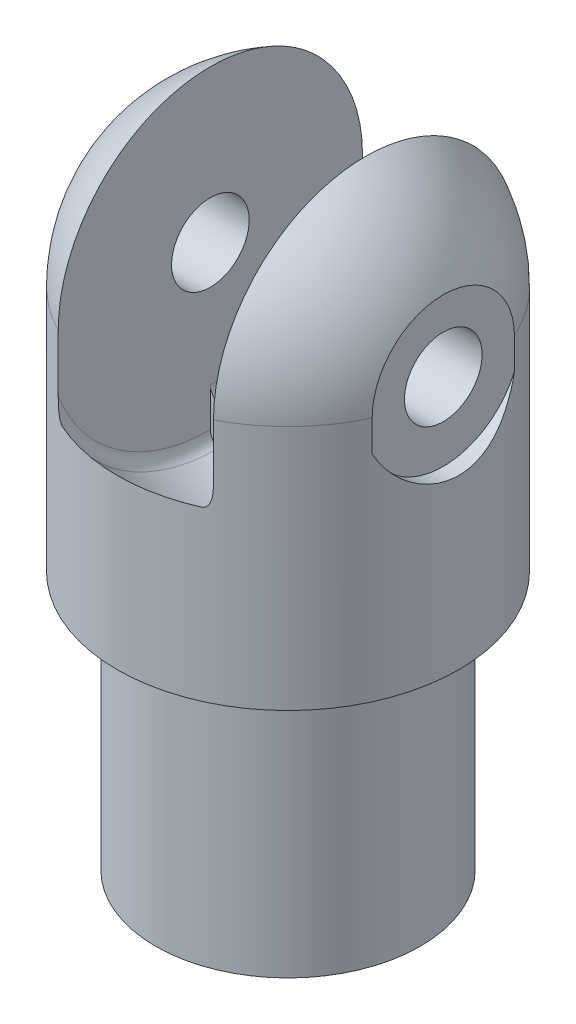
from build123d import *

# Parameters (mm, degrees)
SKETCH1_R                     = 12.9921
BOSS_EXTRUDE1_DEPTH           = 25.4
CUT_EXTRUDE1_DEPTH            = 102.12582981
CUT_EXTRUDE1_DEPTH_BACK       = 102.12582981
SKETCH3_R                     = 3.81
CUT_REVOLVE10_ANGLE           = 90
CUT_REVOLVE10_OTHER_WAY_ANGLE = 180
CUT_EXTRUDE4_DEPTH            = 32.004
FILLET1_R                     = 1.27
SKETCH15_R                    = 7.62
CUT_EXTRUDE5_DEPTH            = 10.16


with BuildPart() as part:
    # Sketch1 → Boss-Extrude1 (new body)
    with BuildSketch(Plane(origin=(0, 0, 0), x_dir=(1, 0, 0), z_dir=(0, 1, 0))):
        Circle(SKETCH1_R)
    extrude(amount=BOSS_EXTRUDE1_DEPTH)

    # Sketch2 → Revolve1 (revolve)
    with BuildSketch(Plane(origin=(0, 0, 0), x_dir=(0, 0, -1), z_dir=(1, 0, 0))):
        with BuildLine():
            Line((-16.764, 25.4), (-16.764, 49.53))
            ThreePointArc((-16.764, 49.53), (-11.85393808, 61.38393808), (0, 66.294))
            Line((0, 66.294), (0, 25.4))
            Line((0, 25.4), (-16.764, 25.4))
        make_face()
    revolve(axis=Axis((0, 25.4, 0), (0, 1, 0)))

    # Sketch3 → Cut-Extrude1 (cut, two sides: drawn at the far end of the back side and taken through both)
    with BuildSketch(Plane(origin=(0, 98.307528007, 0), x_dir=(0, 0, -1), z_dir=(-1, 0, 0)).offset(-CUT_EXTRUDE1_DEPTH_BACK)):
        with Locations((0, 48.777528007)):
            Circle(SKETCH3_R)
    extrude(amount=CUT_EXTRUDE1_DEPTH + CUT_EXTRUDE1_DEPTH_BACK, mode=Mode.SUBTRACT)

    # Sketch11 → Cut-Revolve10 (revolve, cut)
    with BuildSketch(Plane.XY):
        with BuildLine():
            Line((-7.62, 49.53), (-7.62, 66.294481054))
            ThreePointArc((-7.62, 66.294481054), (0, 67.945), (7.62, 66.294481054))
            Line((7.62, 66.294481054), (7.62, 49.53))
            Line((7.62, 49.53), (-7.62, 49.53))
        make_face()
    revolve(axis=Axis((16.764, 49.53, 0), (-1, 0, 0)), revolution_arc=CUT_REVOLVE10_ANGLE, mode=Mode.SUBTRACT)

    # Sketch11 → Cut-Revolve10 other way (revolve, cut)
    with BuildSketch(Plane.XY):
        with BuildLine():
            Line((-7.62, 49.53), (-7.62, 66.294481054))
            ThreePointArc((-7.62, 66.294481054), (0, 67.945), (7.62, 66.294481054))
            Line((7.62, 66.294481054), (7.62, 49.53))
            Line((7.62, 49.53), (-7.62, 49.53))
        make_face()
    revolve(axis=Axis((16.764, 49.53, 0), (1, 0, 0)), revolution_arc=CUT_REVOLVE10_OTHER_WAY_ANGLE, mode=Mode.SUBTRACT)

    # Sketch13 → Cut-Revolve11 (revolve, cut)
    with BuildSketch(Plane.XY):
        with BuildLine():
            Line((-7.62, 53.34), (7.62, 53.34))
            Line((7.62, 53.34), (7.62, 70.104481054))
            ThreePointArc((7.62, 70.104481054), (0, 71.755), (-7.62, 70.104481054))
            Line((-7.62, 70.104481054), (-7.62, 53.34))
        make_face()
    revolve(axis=Axis((-7.62, 53.34, 0), (1, 0, 0)), mode=Mode.SUBTRACT)

    # Sketch14 → Cut-Extrude4 (cut)
    with BuildSketch(Plane.XY):
        with BuildLine():
            Line((-7.62, 49.53), (-7.62, 42.063955264))
            ThreePointArc((-7.62, 42.063955264), (0, 38.862), (7.62, 42.063955264))
            Line((7.62, 42.063955264), (7.62, 49.53))
            Line((7.62, 49.53), (-7.62, 49.53))
        make_face()
    extrude(amount=-CUT_EXTRUDE4_DEPTH, mode=Mode.SUBTRACT)

    # Fillet1
    fillet1_edges = [part.edges().sort_by_distance(p)[0] for p in [
        (-7.62, 35.232956393, 8.754562759),
        (-7.62, 38.008906377, -6.782727573),
        (-7.62, 42.063955264, -13.66883927),
        (7.62, 42.063955264, -13.66883927),
        (7.62, 38.008906377, -6.782727573),
        (7.62, 35.232956393, 8.754562759),
    ]]
    fillet(fillet1_edges, radius=FILLET1_R)

    # Sketch15 → Cut-Extrude5 (cut)
    with BuildSketch(Plane(origin=(-15.24, 0, 0), x_dir=(0, 0, -1), z_dir=(-1, 0, 0))):
        with Locations((0, -49.53)):
            Circle(SKETCH15_R)
    cut_extrude5 = extrude(amount=CUT_EXTRUDE5_DEPTH, mode=Mode.SUBTRACT)

    # Mirror1: Cut-Extrude5 across plane
    add(cut_extrude5.mirror(Plane.ZY), mode=Mode.SUBTRACT)


solid = part.part
